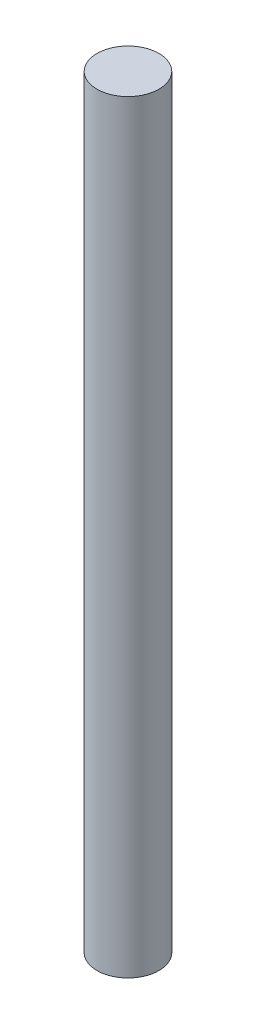
from build123d import *

# Parameters (mm, degrees)
SKETCH1_R           = 1.59
BOSS_EXTRUDE1_DEPTH = 39.16


with BuildPart() as part:
    # Sketch1 → Boss-Extrude1 (new body)
    with BuildSketch(Plane(origin=(0, 0, 0), x_dir=(1, 0, 0), z_dir=(0, 1, 0))):
        with Locations(Location((0, 0, 0), (0, 0, 270))):
            Circle(SKETCH1_R)
    extrude(amount=BOSS_EXTRUDE1_DEPTH)


solid = part.part
